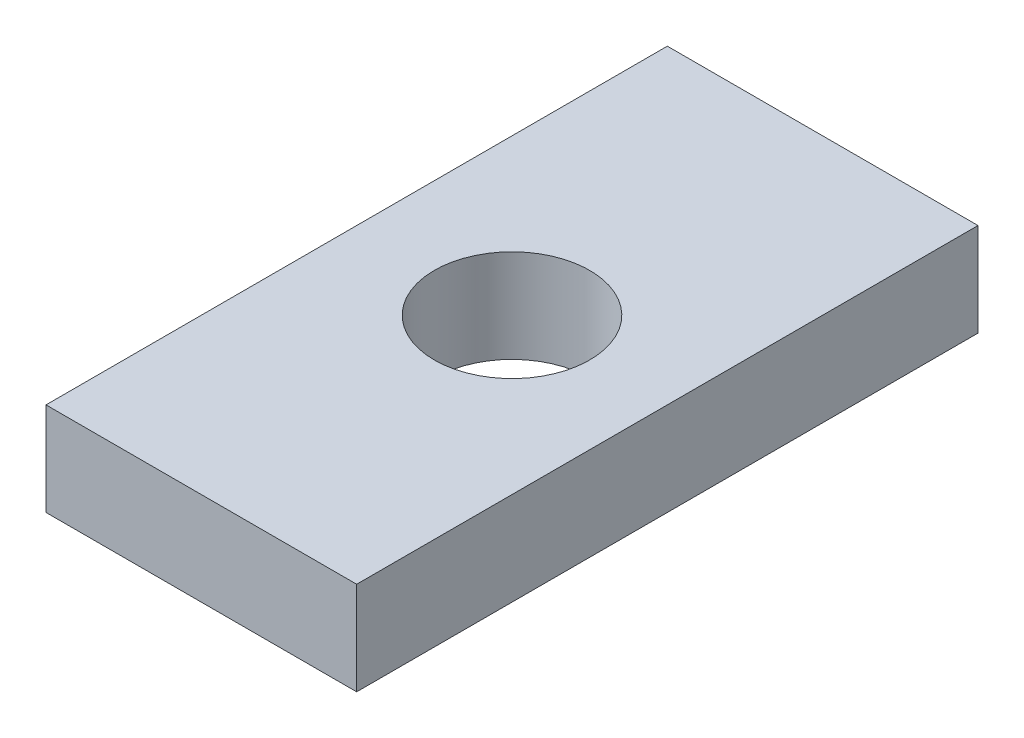
from build123d import *

# Parameters (mm, degrees)
SKETCH_1_W      = 10
SKETCH_1_H      = 20
SKETCH_1_R      = 2.5
EXTRUDE_1_DEPTH = 3


with BuildPart() as part:
    # 草圖1 → 填料-伸長1 (new body)
    with BuildSketch(Plane(origin=(0, 0, 0), x_dir=(1, 0, 0), z_dir=(0, 1, 0))):
        with Locations((-5.91954023, -3.390804598)):
            Rectangle(SKETCH_1_W, SKETCH_1_H)
        with Locations(Location((-5.91954023, -3.390804598, 0), (0, 0, 270))):
            Circle(SKETCH_1_R, mode=Mode.SUBTRACT)
    extrude(amount=EXTRUDE_1_DEPTH)


solid = part.part
